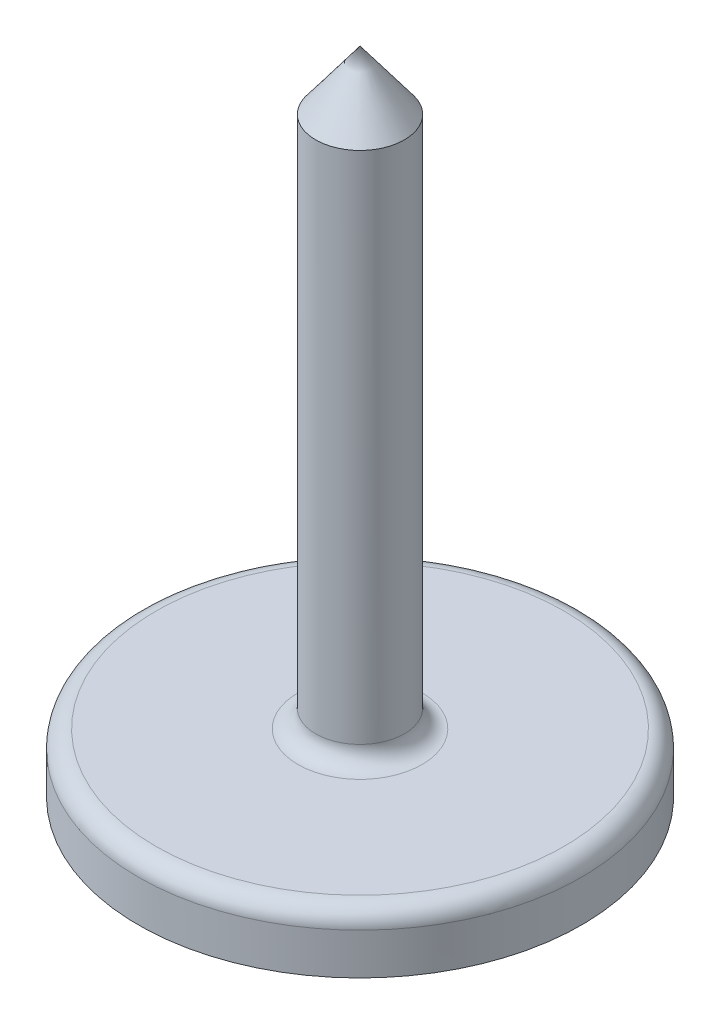
from build123d import *

# Parameters (mm, degrees)
RADYUS1_R = 3


with BuildPart() as part:
    # Çizim1 → Döndür1 (revolve)
    with BuildSketch(Plane.XY, mode=Mode.PRIVATE) as d_nd_r1_sk:
        Polygon((0, 0), (37.5, 0), (37.5, 10), (7.5, 10), (7.5, 100), (0, 110), align=None)
    revolve(d_nd_r1_sk.sketch.rotate(Axis((0, 0, 0), (0, 1, 0)), 90), axis=Axis((0, 0, 0), (0, 1, 0)))

    # Radyus1
    radyus1_edges = [part.edges().sort_by_distance(p)[0] for p in [
        (0, 10, 7.5),
        (0, 10, 37.5),
    ]]
    fillet(radyus1_edges, radius=RADYUS1_R)


solid = part.part
